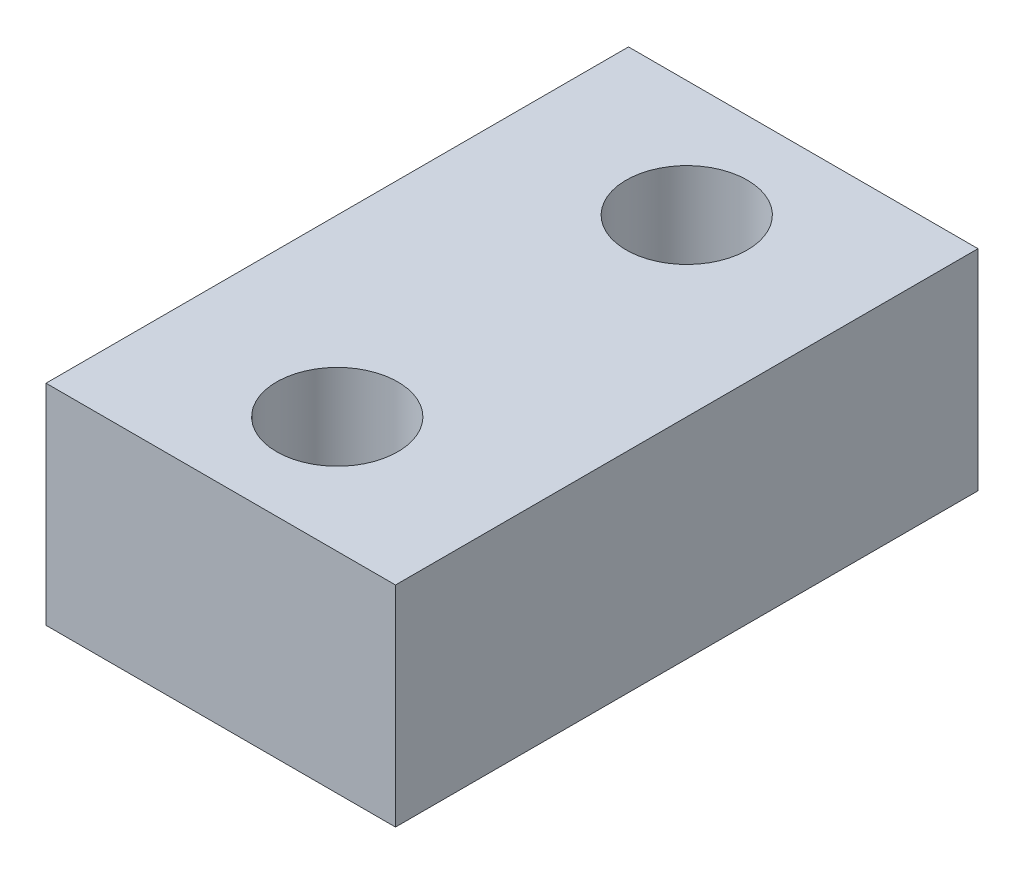
from build123d import *

# Parameters (mm, degrees)
SKETCH_1_W          = 65
SKETCH_1_H          = 25
EXTRUDE_1_DEPTH     = 4
SKETCH_2_W          = 15
SKETCH_2_H          = 25
EXTRUDE_2_DEPTH     = 13
SKETCH_3_R          = 2.6
SKETCH_3_R_2        = 4
CUT_EXTRUDE_1_DEPTH = 39.74919354
SKETCH_5_W          = 15
SKETCH_5_H          = 4
EXTRUDE_3_DEPTH     = 6
SKETCH_6_R          = 1.25
CUT_EXTRUDE_3_DEPTH = 40.59166579
FILLET_2_R          = 3
CUT_EXTRUDE_4_DEPTH = 49.023431781
SKETCH_9_W          = 15
SKETCH_9_H          = 4
CUT_EXTRUDE_5_DEPTH = 42.403502267


with BuildPart() as part:
    # 草图1 → 凸台-拉伸1 (new body)
    with BuildSketch(Plane(origin=(0, 0, 0), x_dir=(1, 0, 0), z_dir=(0, 1, 0))):
        Rectangle(SKETCH_1_W, SKETCH_1_H)
    extrude(amount=EXTRUDE_1_DEPTH)

    # 草图2 → 凸台-拉伸2 (add)
    with BuildSketch(Plane(origin=(0, 4, 0), x_dir=(1, 0, 0), z_dir=(0, 1, 0))):
        Rectangle(SKETCH_2_W, SKETCH_2_H)
    extrude(amount=EXTRUDE_2_DEPTH)

    # 草图3 → 切除-拉伸1 (cut, through all)
    with BuildSketch(Plane.XZ):
        with Locations(Location((0, -7.5, 0), (0, 0, 270))):
            Circle(SKETCH_3_R)
        with Locations(Location((0, 7.5, 0), (0, 0, 90))):
            Circle(SKETCH_3_R)
        with Locations(Location((-22, 0, 0), (0, 0, 270))):
            Circle(SKETCH_3_R_2)
        with Locations(Location((22, 0, 0), (0, 0, 90))):
            Circle(SKETCH_3_R_2)
    extrude(amount=-CUT_EXTRUDE_1_DEPTH, mode=Mode.SUBTRACT)

    # 草图5 → 凸台-拉伸3 (add)
    with BuildSketch(Plane.XY.offset(12.5)):
        with Locations((0, 6)):
            Rectangle(SKETCH_5_W, SKETCH_5_H)
    extrude_3 = extrude(amount=EXTRUDE_3_DEPTH)

    # 草图6 → 切除-拉伸3 (cut, through all)
    with BuildSketch(Plane.XZ.offset(-4)):
        with Locations(Location((-4.5, 15.5, 0), (0, 0, 270))):
            Circle(SKETCH_6_R)
        with Locations(Location((4.5, 15.5, 0), (0, 0, 270))):
            Circle(SKETCH_6_R)
    cut_extrude_3 = extrude(amount=-CUT_EXTRUDE_3_DEPTH, mode=Mode.SUBTRACT)

    # 镜向2: 凸台-拉伸3, 切除-拉伸3 across plane
    add(extrude_3.mirror(Plane.XY))
    add(cut_extrude_3.mirror(Plane.XY), mode=Mode.SUBTRACT)

    # 圆角2
    fillet_2_edges = [part.edges().sort_by_distance(p)[0] for p in [
        (-7.5, 6, 18.5),
        (7.5, 6, 18.5),
        (-7.5, 6, -18.5),
        (7.5, 6, -18.5),
    ]]
    fillet(fillet_2_edges, radius=FILLET_2_R)

    # 草图7 → 切除-拉伸4 (cut, through all)
    with BuildSketch(Plane(origin=(0, 0, -12.5), x_dir=(-1, 0, 0), z_dir=(0, 0, -1))):
        Polygon((32.5, 4), (7.5, 4), (-7.5, 4), (-32.5, 4), (-32.5, 0), (32.5, 0), align=None)
    extrude(amount=-CUT_EXTRUDE_4_DEPTH, mode=Mode.SUBTRACT)

    # 草图9 → 切除-拉伸5 (cut, through all)
    with BuildSketch(Plane.XY.offset(18.5)):
        with Locations((0, 6)):
            Rectangle(SKETCH_9_W, SKETCH_9_H)
    extrude(amount=-CUT_EXTRUDE_5_DEPTH, mode=Mode.SUBTRACT)


solid = part.part
